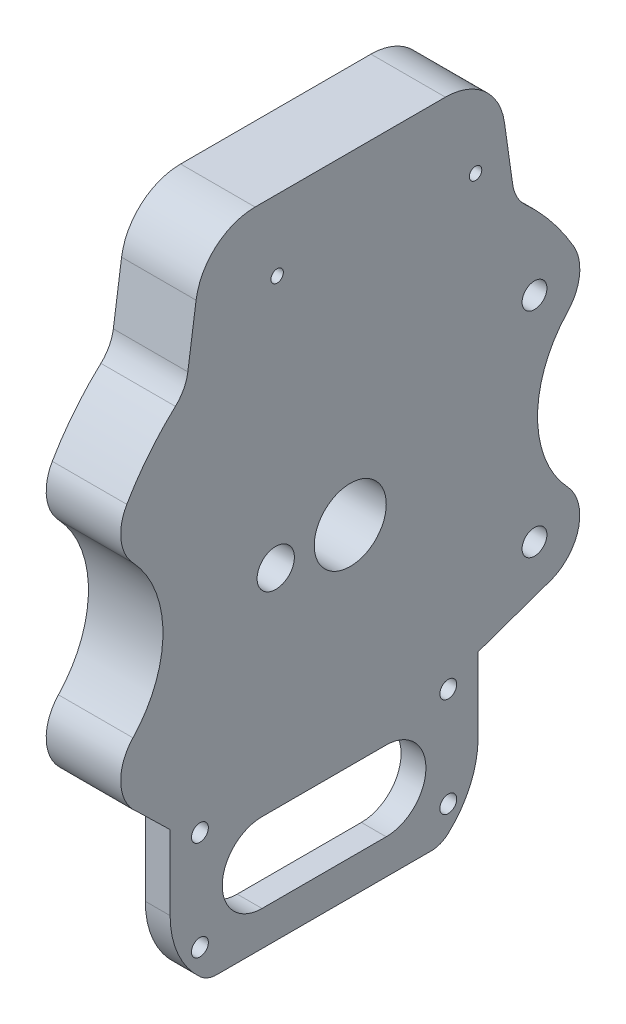
from build123d import *

# Parameters (mm, degrees)
SZKIC1_R                         = 14.5
SZKIC1_R_2                       = 5
DODANIE_WYCI_GNI_CIE1_DEPTH      = 15
OTW_R_GWINTOWANY_M61_D           = 5
WYTNIJ_WYCI_GNI_CIE2_DEPTH       = 10
WYTNIJ_WYCI_GNI_CIE4_START       = 20
WYTNIJ_WYCI_GNI_CIE4_DEPTH       = 20
SFAZOWANIE4_SIZE                 = 10
SZKIC17_R                        = 7.5
WYTNIJ_WYCI_GNI_CIE5_DEPTH       = 5
SZKIC17_5_R                      = 7.5
WYTNIJ_WYCI_GNI_CIE6_DEPTH       = 163.311542951
OTW_R_GWINTOWANY_M81_D           = 6.8
OTW_R_GWINTOWANY_M81_DEPTH       = 16.207073895
OTW_R_GWINTOWANY_M81_CSINK_D     = 8.05
OTW_R_GWINTOWANY_M81_CSINK_ANGLE = 90
OTW_R_GWINTOWANY_M81_TIP         = 2.042926105


with BuildPart() as part:
    # Szkic1 → Dodanie-wyciągnięcie1 (new, symmetric)
    with BuildSketch(Plane(origin=(0, 0, 0), x_dir=(0, 0, -1), z_dir=(1, 0, 0))):
        with BuildLine():
            Line((-72.530533194, -70), (-85.848604083, -57.040111879))
            ThreePointArc((-85.848604083, -57.040111879), (-92.404294481, -44.130927243), (-87.495806927, -30.50995538))
            ThreePointArc((-87.495806927, -30.50995538), (-75.419960244, 0), (-87.495806927, 30.50995538))
            ThreePointArc((-87.495806927, 30.50995538), (-92.32041193, 40.919666146), (-89.978943384, 52.151603499))
            ThreePointArc((-89.978943384, 52.151603499), (-81.115709466, 65.086416999), (-70.408575711, 76.541704099))
            ThreePointArc((-70.408575711, 76.541704099), (-67.080888035, 80.867469231), (-65.40069858, 86.060032436))
            Line((-65.40069858, 86.060032436), (-62.076569761, 109.385977671))
            ThreePointArc((-62.076569761, 109.385977671), (-54.044566654, 124.12820267), (-38.316621209, 130))
            Line((-38.316621209, 130), (38.316621209, 130))
            ThreePointArc((38.316621209, 130), (54.044566654, 124.12820267), (62.076569761, 109.385977671))
            Line((62.076569761, 109.385977671), (65.40069858, 86.060032436))
            ThreePointArc((65.40069858, 86.060032436), (67.080888035, 80.867469231), (70.408575711, 76.541704099))
            ThreePointArc((70.408575711, 76.541704099), (81.115709466, 65.086416999), (89.978943384, 52.151603499))
            ThreePointArc((89.978943384, 52.151603499), (92.32041193, 40.919666146), (87.495806927, 30.50995538))
            ThreePointArc((87.495806927, 30.50995538), (75.419960244, 0), (87.495806927, -30.50995538))
            ThreePointArc((87.495806927, -30.50995538), (92.006314233, -46.663708643), (81.240664282, -59.524081957))
            Line((81.240664282, -59.524081957), (51.469466806, -70))
            Line((51.469466806, -70), (51.469466806, -100))
            ThreePointArc((51.469466806, -100), (48.29757558, -114.988630917), (39.325734007, -127.407407407))
            ThreePointArc((39.325734007, -127.407407407), (36.208235452, -129.329364235), (32.607823953, -130))
            Line((32.607823953, -130), (14.469466806, -130))
            Line((14.469466806, -130), (-35.530533194, -130))
            Line((-35.530533194, -130), (-53.668890342, -130))
            ThreePointArc((-53.668890342, -130), (-57.269301841, -129.329364235), (-60.386800396, -127.407407407))
            ThreePointArc((-60.386800396, -127.407407407), (-69.358641969, -114.988630917), (-72.530533194, -100))
            Line((-72.530533194, -100), (-72.530533194, -70))
        make_face()
        Circle(SZKIC1_R, mode=Mode.SUBTRACT)
        with Locations((74.189369185, -43)):
            Circle(SZKIC1_R_2, mode=Mode.SUBTRACT)
        with Locations((74.189369185, 43)):
            Circle(SZKIC1_R_2, mode=Mode.SUBTRACT)
        with BuildLine():
            Line((14.469466806, -84), (-35.530533194, -84))
            ThreePointArc((-35.530533194, -84), (-51.530533194, -100), (-35.530533194, -116))
            Line((-35.530533194, -116), (14.469466806, -116))
            ThreePointArc((14.469466806, -116), (30.469466806, -100), (14.469466806, -84))
        make_face(mode=Mode.SUBTRACT)
    extrude(amount=DODANIE_WYCI_GNI_CIE1_DEPTH, both=True)

    # Otwór gwintowany M61 (through all)
    with Locations(Plane(origin=(-15, 0, 0), x_dir=(0, 0, -1), z_dir=(-1, 0, 0))):
        with Locations((-29.434757864, -101.542610293), (50.455604917, -97.355733794)):
            Hole(OTW_R_GWINTOWANY_M61_D / 2)

    # Szkic12 → Wytnij-wyciągnięcie2 (cut)
    with BuildSketch(Plane(origin=(-15, 0, 0), x_dir=(0, 0, -1), z_dir=(1, 0, 0))):
        with BuildLine():
            Line((28.802174659, 93.483680258), (-9.732880373, 95.503216916))
            ThreePointArc((-9.732880373, 95.503216916), (-14.464348266, 100.758044371), (-9.209520811, 105.489512264))
            Line((-9.209520811, 105.489512264), (29.325534221, 103.469975605))
            ThreePointArc((29.325534221, 103.469975605), (34.057002114, 98.21514815), (28.802174659, 93.483680258))
        make_face()
    extrude(amount=WYTNIJ_WYCI_GNI_CIE2_DEPTH, mode=Mode.SUBTRACT)

    # Szkic16 → Wytnij-wyciągnięcie4 (cut)
    with BuildSketch(Plane(origin=(-15, 0, 0), x_dir=(0, 0, -1), z_dir=(1, 0, 0)).offset(WYTNIJ_WYCI_GNI_CIE4_START)):
        with BuildLine():
            Line((-53.668890342, -130), (32.607823953, -130))
            ThreePointArc((32.607823953, -130), (36.208235452, -129.329364235), (39.325734007, -127.407407407))
            ThreePointArc((39.325734007, -127.407407407), (48.29757558, -114.988630917), (51.469466806, -100))
            Line((51.469466806, -100), (51.469466806, -70))
            Line((51.469466806, -70), (-72.530533194, -70))
            Line((-72.530533194, -70), (-72.530533194, -100))
            ThreePointArc((-72.530533194, -100), (-69.358641969, -114.988630917), (-60.386800396, -127.407407407))
            ThreePointArc((-60.386800396, -127.407407407), (-57.269301841, -129.329364235), (-53.668890342, -130))
        make_face()
        with BuildLine():
            Line((-35.530533194, -116), (14.469466806, -116))
            ThreePointArc((14.469466806, -116), (30.469466806, -100), (14.469466806, -84))
            Line((14.469466806, -84), (-35.530533194, -84))
            ThreePointArc((-35.530533194, -84), (-51.530533194, -100), (-35.530533194, -116))
        make_face(mode=Mode.SUBTRACT)
    extrude(amount=-WYTNIJ_WYCI_GNI_CIE4_DEPTH, mode=Mode.SUBTRACT)

    # Sfazowanie4
    sfazowanie4_edges = [part.edges().sort_by_distance(p)[0] for p in [
        (-15, -70, 10.530533194),
    ]]
    chamfer(sfazowanie4_edges, length=SFAZOWANIE4_SIZE)

    # Szkic17 → Wytnij-wyciągnięcie5 (cut)
    with BuildSketch(Plane(origin=(-15, 0, 0), x_dir=(0, 0, -1), z_dir=(1, 0, 0))):
        with BuildLine():
            Line((-45.292857142, 8.957177033), (-31.578571428, 10.93666367))
            ThreePointArc((-31.578571428, 10.93666367), (-22.462605729, 8.080234378), (-18.98012619, -0.815402484))
            ThreePointArc((-18.98012619, -0.815402484), (-23.079412621, -8.614404816), (-31.578571429, -10.936663671))
            Line((-31.578571429, -10.936663671), (-45.292857143, -8.957177034))
            ThreePointArc((-45.292857143, -8.957177034), (-53.05, 0), (-45.292857142, 8.957177033))
        make_face()
        with Locations((-30, -1e-09)):
            Circle(SZKIC17_R, mode=Mode.SUBTRACT)
    extrude(amount=WYTNIJ_WYCI_GNI_CIE5_DEPTH, mode=Mode.SUBTRACT)

    # Szkic17<5> → Wytnij-wyciągnięcie6 (cut, through all)
    with BuildSketch(Plane(origin=(-15, 0, 0), x_dir=(0, 0, -1), z_dir=(1, 0, 0))):
        with Locations((-30, -1e-09)):
            Circle(SZKIC17_5_R)
    extrude(amount=WYTNIJ_WYCI_GNI_CIE6_DEPTH, mode=Mode.SUBTRACT)

    # Otwór gwintowany M81
    with Locations(Plane(origin=(5, -77, -39.469466806), x_dir=(0, 0, -1), z_dir=(-1, 0, 0))):
        with Locations((0, 0), (0, 40), (-100, 40), (-100, 0)):
            CounterSinkHole(OTW_R_GWINTOWANY_M81_D / 2, OTW_R_GWINTOWANY_M81_CSINK_D / 2, depth=OTW_R_GWINTOWANY_M81_DEPTH, counter_sink_angle=OTW_R_GWINTOWANY_M81_CSINK_ANGLE)
            with Locations((0, 0, -(OTW_R_GWINTOWANY_M81_DEPTH + OTW_R_GWINTOWANY_M81_TIP / 2))):  # 118° drill point
                Cone(0, OTW_R_GWINTOWANY_M81_D / 2, OTW_R_GWINTOWANY_M81_TIP, mode=Mode.SUBTRACT)


solid = part.part
